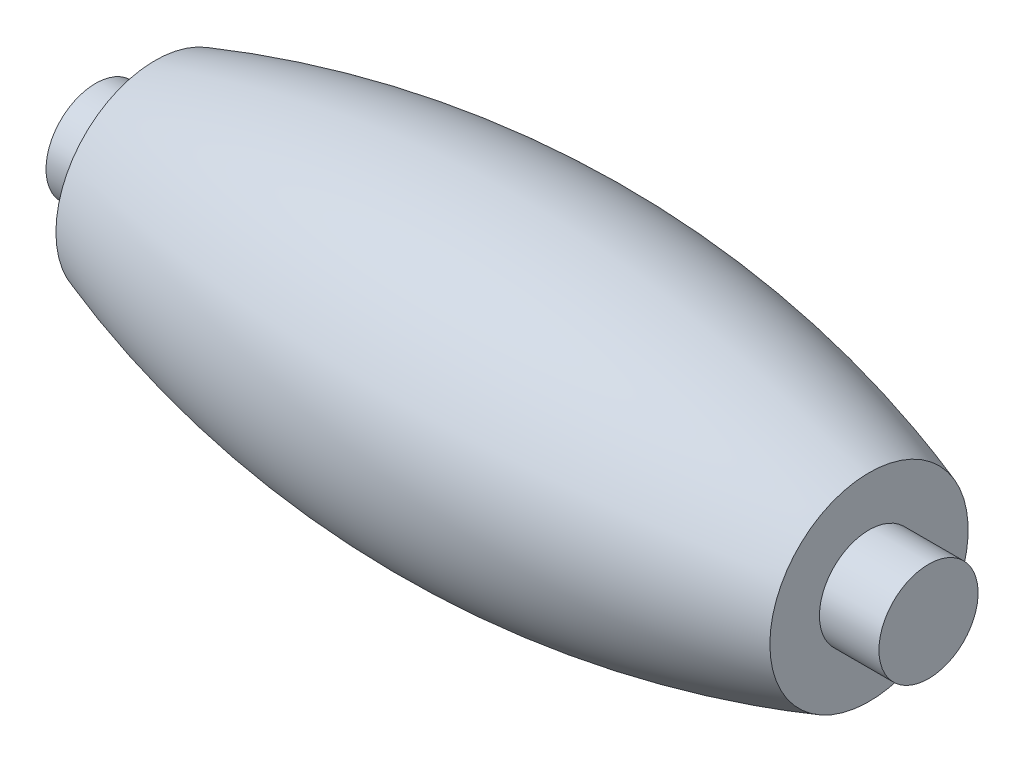
from build123d import *


with BuildPart() as part:
    # Sketch2 → Revolve1 (revolve)
    with BuildSketch(Plane(origin=(0, 0, 0), x_dir=(1, 0, 0), z_dir=(0, 1, 0)), mode=Mode.PRIVATE) as revolve1_sk:
        with BuildLine():
            Line((0, 0), (0, 2.5))
            Line((0, 2.5), (3, 2.5))
            Line((3, 2.5), (3, 5))
            ThreePointArc((3, 5), (21, 8.00892975), (39, 5))
            Line((39, 5), (39, 2.5))
            Line((39, 2.5), (42, 2.5))
            Line((42, 2.5), (42, 0))
            Line((42, 0), (0, 0))
        make_face()
    revolve(revolve1_sk.sketch.rotate(Axis((0, 0, 0), (1, 0, 0)), 180), axis=Axis((0, 0, 0), (1, 0, 0)))


solid = part.part
